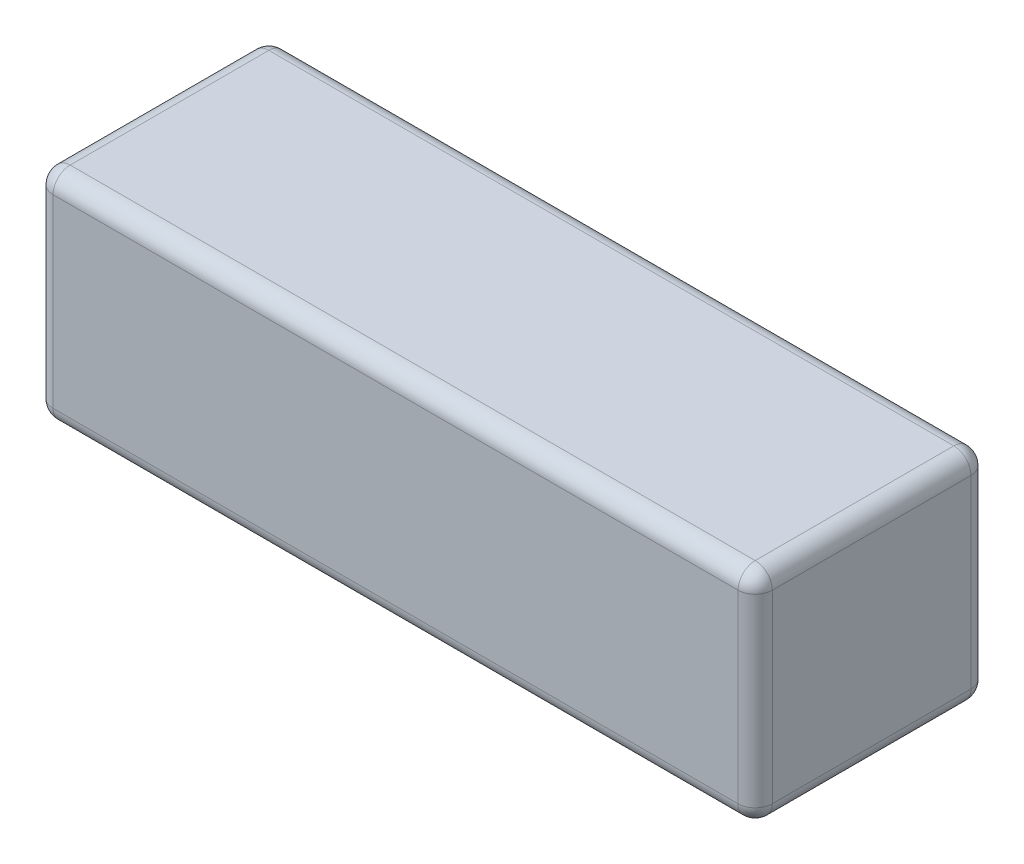
from build123d import *

# Parameters (mm, degrees)
SKETCH1_W           = 105
SKETCH1_H           = 34
BOSS_EXTRUDE1_DEPTH = 32
FILLET1_R           = 2.5


with BuildPart() as part:
    # Sketch1 → Boss-Extrude1 (new body)
    with BuildSketch(Plane(origin=(0, 0, 0), x_dir=(1, 0, 0), z_dir=(0, 1, 0))):
        with Locations((52.5, 17)):
            Rectangle(SKETCH1_W, SKETCH1_H)
    extrude(amount=BOSS_EXTRUDE1_DEPTH)

    # Fillet1
    fillet1_edges = [part.edges().sort_by_distance(p)[0] for p in [
        (105, 32, -17),
        (52.5, 32, -34),
        (0, 32, -17),
        (52.5, 0, -34),
        (105, 0, -17),
        (52.5, 0, 0),
        (0, 0, -17),
        (0, 16, -34),
        (105, 16, -34),
        (105, 16, 0),
        (0, 16, 0),
        (52.5, 32, 0),
    ]]
    fillet(fillet1_edges, radius=FILLET1_R)


solid = part.part
